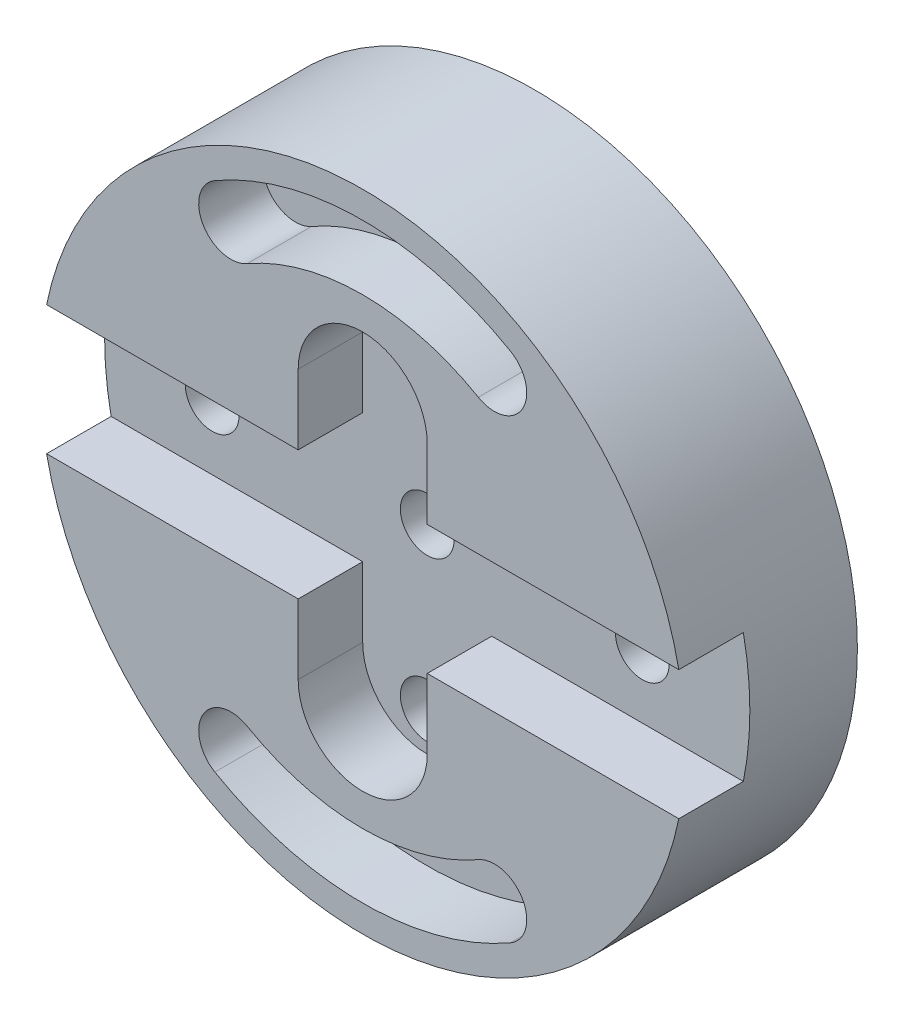
from build123d import *

# Parameters (mm, degrees)
SKETCH1_R           = 60
BOSS_EXTRUDE1_DEPTH = 32
CUT_EXTRUDE1_DEPTH  = 12
CUT_EXTRUDE2_DEPTH  = 12
SKETCH4_R           = 5
CUT_EXTRUDE3_DEPTH  = 92


with BuildPart() as part:
    # Sketch1 → Boss-Extrude1 (new body)
    with BuildSketch(Plane.XY):
        Circle(SKETCH1_R)
    extrude(amount=BOSS_EXTRUDE1_DEPTH)

    # Sketch2 → Cut-Extrude1 (cut)
    with BuildSketch(Plane.XY.offset(32)):
        with BuildLine():
            Line((12, -12), (72.488491821, -12))
            Line((72.488491821, -12), (72.488491821, 12))
            Line((72.488491821, 12), (12, 12))
            Line((12, 12), (12, 25))
            ThreePointArc((12, 25), (0, 37), (-12, 25))
            Line((-12, 25), (-12, 12))
            Line((-12, 12), (-72.488491821, 12))
            Line((-72.488491821, 12), (-72.488491821, -12))
            Line((-72.488491821, -12), (-12, -12))
            Line((-12, -12), (-12, -25))
            ThreePointArc((-12, -25), (0, -37), (12, -25))
            Line((12, -25), (12, -12))
        make_face()
    extrude(amount=-CUT_EXTRUDE1_DEPTH, mode=Mode.SUBTRACT)

    # Sketch3 → Cut-Extrude2 (cut)
    with BuildSketch(Plane.XY.offset(32)):
        with BuildLine():
            ThreePointArc((21.5, -37.239092363), (29.696152423, -39.435244785), (27.5, -47.631397208))
            ThreePointArc((27.5, -47.631397208), (0, -55), (-27.5, -47.631397208))
            ThreePointArc((-27.5, -47.631397208), (-29.696152423, -39.435244785), (-21.5, -37.239092363))
            ThreePointArc((-21.5, -37.239092363), (0, -43), (21.5, -37.239092363))
        make_face()
        with BuildLine():
            ThreePointArc((27.5, 47.631397208), (0, 55), (-27.5, 47.631397208))
            ThreePointArc((-27.5, 47.631397208), (-29.696152423, 39.435244785), (-21.5, 37.239092363))
            ThreePointArc((-21.5, 37.239092363), (0, 43), (21.5, 37.239092363))
            ThreePointArc((21.5, 37.239092363), (29.696152423, 39.435244785), (27.5, 47.631397208))
        make_face()
    extrude(amount=-CUT_EXTRUDE2_DEPTH, mode=Mode.SUBTRACT)

    # Sketch4 → Cut-Extrude3 (cut)
    with BuildSketch(Plane.XY.offset(20)):
        Circle(SKETCH4_R)
        with Locations((40, 0)):
            Circle(SKETCH4_R)
        with Locations((0, 30)):
            Circle(SKETCH4_R)
        with Locations((0, -30)):
            Circle(SKETCH4_R)
        with Locations((-40, 0)):
            Circle(SKETCH4_R)
    extrude(amount=-CUT_EXTRUDE3_DEPTH, mode=Mode.SUBTRACT)


solid = part.part
